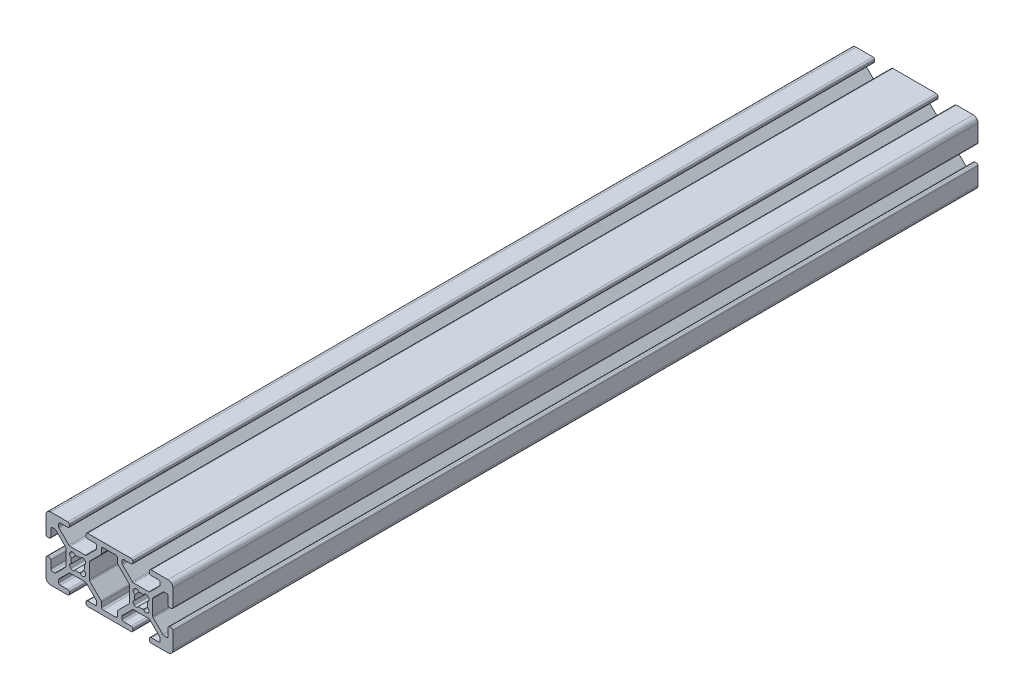
from build123d import *

# Parameters (mm, degrees)
EXTRUDE1_DEPTH = 254


with BuildPart() as part:
    # Sketch1 → Extrude1 (new body)
    with BuildSketch(Plane.XY):
        with BuildLine():
            Line((-36.908207136, -63.334998016), (-32.140368459, -63.334998016))
            ThreePointArc((-32.140368459, -63.334998016), (-31.945965275, -63.373667213), (-31.781158214, -63.483787771))
            Line((-31.781158214, -63.483787771), (-28.678077553, -66.586868432))
            ThreePointArc((-28.678077553, -66.586868432), (-28.567956995, -66.751675493), (-28.529287798, -66.946078677))
            Line((-28.529287798, -66.946078677), (-28.529287798, -67.671998016))
            ThreePointArc((-28.529287798, -67.671998016), (-28.678077553, -68.03120826), (-29.037287798, -68.179998016))
            Line((-29.037287798, -68.179998016), (-31.386287798, -68.179998016))
            ThreePointArc((-31.386287798, -68.179998016), (-31.745498042, -68.328787771), (-31.894287798, -68.687998016))
            Line((-31.894287798, -68.687998016), (-31.894287798, -69.171998016))
            ThreePointArc((-31.894287798, -69.171998016), (-31.745498042, -69.53120826), (-31.386287798, -69.679998016))
            Line((-31.386287798, -69.679998016), (-17.662287798, -69.679998016))
            ThreePointArc((-17.662287798, -69.679998016), (-17.303077553, -69.53120826), (-17.154287798, -69.171998016))
            Line((-17.154287798, -69.171998016), (-17.154287798, -68.687998016))
            ThreePointArc((-17.154287798, -68.687998016), (-17.303077553, -68.328787771), (-17.662287798, -68.179998016))
            Line((-17.662287798, -68.179998016), (-20.011287798, -68.179998016))
            ThreePointArc((-20.011287798, -68.179998016), (-20.370498042, -68.03120826), (-20.519287798, -67.671998016))
            Line((-20.519287798, -67.671998016), (-20.519287798, -66.946078677))
            ThreePointArc((-20.519287798, -66.946078677), (-20.4806186, -66.751675493), (-20.370498042, -66.586868432))
            Line((-20.370498042, -66.586868432), (-17.267417381, -63.483787771))
            ThreePointArc((-17.267417381, -63.483787771), (-17.10261032, -63.373667213), (-16.908207136, -63.334998016))
            Line((-16.908207136, -63.334998016), (-12.140368459, -63.334998016))
            ThreePointArc((-12.140368459, -63.334998016), (-11.945965275, -63.373667213), (-11.781158214, -63.483787771))
            Line((-11.781158214, -63.483787771), (-8.678077553, -66.586868432))
            ThreePointArc((-8.678077553, -66.586868432), (-8.567956995, -66.751675493), (-8.529287798, -66.946078677))
            Line((-8.529287798, -66.946078677), (-8.529287798, -67.671998016))
            ThreePointArc((-8.529287798, -67.671998016), (-8.678077553, -68.03120826), (-9.037287798, -68.179998016))
            Line((-9.037287798, -68.179998016), (-11.386287798, -68.179998016))
            ThreePointArc((-11.386287798, -68.179998016), (-11.745498042, -68.328787771), (-11.894287798, -68.687998016))
            Line((-11.894287798, -68.687998016), (-11.894287798, -69.171998016))
            ThreePointArc((-11.894287798, -69.171998016), (-11.745498042, -69.53120826), (-11.386287798, -69.679998016))
            Line((-11.386287798, -69.679998016), (-6.024287798, -69.679998016))
            ThreePointArc((-6.024287798, -69.679998016), (-4.963627626, -69.240658187), (-4.524287798, -68.179998016))
            Line((-4.524287798, -68.179998016), (-4.524287798, -62.817998016))
            ThreePointArc((-4.524287798, -62.817998016), (-4.673077553, -62.458787771), (-5.032287798, -62.309998016))
            Line((-5.032287798, -62.309998016), (-5.516287798, -62.309998016))
            ThreePointArc((-5.516287798, -62.309998016), (-5.875498042, -62.458787771), (-6.024287798, -62.817998016))
            Line((-6.024287798, -62.817998016), (-6.024287798, -65.166998016))
            ThreePointArc((-6.024287798, -65.166998016), (-6.173077553, -65.52620826), (-6.532287798, -65.674998016))
            Line((-6.532287798, -65.674998016), (-7.258207136, -65.674998016))
            ThreePointArc((-7.258207136, -65.674998016), (-7.45261032, -65.636328818), (-7.617417381, -65.52620826))
            Line((-7.617417381, -65.52620826), (-10.720498042, -62.423127599))
            ThreePointArc((-10.720498042, -62.423127599), (-10.8306186, -62.258320538), (-10.869287798, -62.063917354))
            Line((-10.869287798, -62.063917354), (-10.869287798, -57.296078677))
            ThreePointArc((-10.869287798, -57.296078677), (-10.8306186, -57.101675493), (-10.720498042, -56.936868432))
            Line((-10.720498042, -56.936868432), (-7.617417381, -53.833787771))
            ThreePointArc((-7.617417381, -53.833787771), (-7.45261032, -53.723667213), (-7.258207136, -53.684998016))
            Line((-7.258207136, -53.684998016), (-6.532287798, -53.684998016))
            ThreePointArc((-6.532287798, -53.684998016), (-6.173077553, -53.833787771), (-6.024287798, -54.192998016))
            Line((-6.024287798, -54.192998016), (-6.024287798, -56.541998016))
            ThreePointArc((-6.024287798, -56.541998016), (-5.875498042, -56.90120826), (-5.516287798, -57.049998016))
            Line((-5.516287798, -57.049998016), (-5.032287798, -57.049998016))
            ThreePointArc((-5.032287798, -57.049998016), (-4.673077553, -56.90120826), (-4.524287798, -56.541998016))
            Line((-4.524287798, -56.541998016), (-4.524287798, -51.179998016))
            ThreePointArc((-4.524287798, -51.179998016), (-4.963627626, -50.119337844), (-6.024287798, -49.679998016))
            Line((-6.024287798, -49.679998016), (-11.386287798, -49.679998016))
            ThreePointArc((-11.386287798, -49.679998016), (-11.745498042, -49.828787771), (-11.894287798, -50.187998016))
            Line((-11.894287798, -50.187998016), (-11.894287798, -50.671998016))
            ThreePointArc((-11.894287798, -50.671998016), (-11.745498042, -51.03120826), (-11.386287798, -51.179998016))
            Line((-11.386287798, -51.179998016), (-9.037287798, -51.179998016))
            ThreePointArc((-9.037287798, -51.179998016), (-8.678077553, -51.328787771), (-8.529287798, -51.687998016))
            Line((-8.529287798, -51.687998016), (-8.529287798, -52.413917354))
            ThreePointArc((-8.529287798, -52.413917354), (-8.567956995, -52.608320538), (-8.678077553, -52.773127599))
            Line((-8.678077553, -52.773127599), (-11.781158214, -55.87620826))
            ThreePointArc((-11.781158214, -55.87620826), (-11.945965275, -55.986328818), (-12.140368459, -56.024998016))
            Line((-12.140368459, -56.024998016), (-16.908207136, -56.024998016))
            ThreePointArc((-16.908207136, -56.024998016), (-17.10261032, -55.986328818), (-17.267417381, -55.87620826))
            Line((-17.267417381, -55.87620826), (-20.370498042, -52.773127599))
            ThreePointArc((-20.370498042, -52.773127599), (-20.4806186, -52.608320538), (-20.519287798, -52.413917354))
            Line((-20.519287798, -52.413917354), (-20.519287798, -51.687998016))
            ThreePointArc((-20.519287798, -51.687998016), (-20.370498042, -51.328787771), (-20.011287798, -51.179998016))
            Line((-20.011287798, -51.179998016), (-17.662287798, -51.179998016))
            ThreePointArc((-17.662287798, -51.179998016), (-17.303077553, -51.03120826), (-17.154287798, -50.671998016))
            Line((-17.154287798, -50.671998016), (-17.154287798, -50.187998016))
            ThreePointArc((-17.154287798, -50.187998016), (-17.303077553, -49.828787771), (-17.662287798, -49.679998016))
            Line((-17.662287798, -49.679998016), (-31.386287798, -49.679998016))
            ThreePointArc((-31.386287798, -49.679998016), (-31.745498042, -49.828787771), (-31.894287798, -50.187998016))
            Line((-31.894287798, -50.187998016), (-31.894287798, -50.671998016))
            ThreePointArc((-31.894287798, -50.671998016), (-31.745498042, -51.03120826), (-31.386287798, -51.179998016))
            Line((-31.386287798, -51.179998016), (-29.037287798, -51.179998016))
            ThreePointArc((-29.037287798, -51.179998016), (-28.678077553, -51.328787771), (-28.529287798, -51.687998016))
            Line((-28.529287798, -51.687998016), (-28.529287798, -52.413917354))
            ThreePointArc((-28.529287798, -52.413917354), (-28.567956995, -52.608320538), (-28.678077553, -52.773127599))
            Line((-28.678077553, -52.773127599), (-31.781158214, -55.87620826))
            ThreePointArc((-31.781158214, -55.87620826), (-31.945965275, -55.986328818), (-32.140368459, -56.024998016))
            Line((-32.140368459, -56.024998016), (-36.908207136, -56.024998016))
            ThreePointArc((-36.908207136, -56.024998016), (-37.10261032, -55.986328818), (-37.267417381, -55.87620826))
            Line((-37.267417381, -55.87620826), (-40.370498042, -52.773127599))
            ThreePointArc((-40.370498042, -52.773127599), (-40.4806186, -52.608320538), (-40.519287798, -52.413917354))
            Line((-40.519287798, -52.413917354), (-40.519287798, -51.687998016))
            ThreePointArc((-40.519287798, -51.687998016), (-40.370498042, -51.328787771), (-40.011287798, -51.179998016))
            Line((-40.011287798, -51.179998016), (-37.662287798, -51.179998016))
            ThreePointArc((-37.662287798, -51.179998016), (-37.303077553, -51.03120826), (-37.154287798, -50.671998016))
            Line((-37.154287798, -50.671998016), (-37.154287798, -50.187998016))
            ThreePointArc((-37.154287798, -50.187998016), (-37.303077553, -49.828787771), (-37.662287798, -49.679998016))
            Line((-37.662287798, -49.679998016), (-43.024287798, -49.679998016))
            ThreePointArc((-43.024287798, -49.679998016), (-44.084947969, -50.119337844), (-44.524287798, -51.179998016))
            Line((-44.524287798, -51.179998016), (-44.524287798, -56.541998016))
            ThreePointArc((-44.524287798, -56.541998016), (-44.375498042, -56.90120826), (-44.016287798, -57.049998016))
            Line((-44.016287798, -57.049998016), (-43.532287798, -57.049998016))
            ThreePointArc((-43.532287798, -57.049998016), (-43.173077553, -56.90120826), (-43.024287798, -56.541998016))
            Line((-43.024287798, -56.541998016), (-43.024287798, -54.192998016))
            ThreePointArc((-43.024287798, -54.192998016), (-42.875498042, -53.833787771), (-42.516287798, -53.684998016))
            Line((-42.516287798, -53.684998016), (-41.790368459, -53.684998016))
            ThreePointArc((-41.790368459, -53.684998016), (-41.595965275, -53.723667213), (-41.431158214, -53.833787771))
            Line((-41.431158214, -53.833787771), (-38.328077553, -56.936868432))
            ThreePointArc((-38.328077553, -56.936868432), (-38.217956995, -57.101675493), (-38.179287798, -57.296078677))
            Line((-38.179287798, -57.296078677), (-38.179287798, -62.063917354))
            ThreePointArc((-38.179287798, -62.063917354), (-38.217956995, -62.258320538), (-38.328077553, -62.423127599))
            Line((-38.328077553, -62.423127599), (-41.431158214, -65.52620826))
            ThreePointArc((-41.431158214, -65.52620826), (-41.595965275, -65.636328818), (-41.790368459, -65.674998016))
            Line((-41.790368459, -65.674998016), (-42.516287798, -65.674998016))
            ThreePointArc((-42.516287798, -65.674998016), (-42.875498042, -65.52620826), (-43.024287798, -65.166998016))
            Line((-43.024287798, -65.166998016), (-43.024287798, -62.817998016))
            ThreePointArc((-43.024287798, -62.817998016), (-43.173077553, -62.458787771), (-43.532287798, -62.309998016))
            Line((-43.532287798, -62.309998016), (-44.016287798, -62.309998016))
            ThreePointArc((-44.016287798, -62.309998016), (-44.375498042, -62.458787771), (-44.524287798, -62.817998016))
            Line((-44.524287798, -62.817998016), (-44.524287798, -68.179998016))
            ThreePointArc((-44.524287798, -68.179998016), (-44.084947969, -69.240658187), (-43.024287798, -69.679998016))
            Line((-43.024287798, -69.679998016), (-37.662287798, -69.679998016))
            ThreePointArc((-37.662287798, -69.679998016), (-37.303077553, -69.53120826), (-37.154287798, -69.171998016))
            Line((-37.154287798, -69.171998016), (-37.154287798, -68.687998016))
            ThreePointArc((-37.154287798, -68.687998016), (-37.303077553, -68.328787771), (-37.662287798, -68.179998016))
            Line((-37.662287798, -68.179998016), (-40.011287798, -68.179998016))
            ThreePointArc((-40.011287798, -68.179998016), (-40.370498042, -68.03120826), (-40.519287798, -67.671998016))
            Line((-40.519287798, -67.671998016), (-40.519287798, -66.946078677))
            ThreePointArc((-40.519287798, -66.946078677), (-40.4806186, -66.751675493), (-40.370498042, -66.586868432))
            Line((-40.370498042, -66.586868432), (-37.267417381, -63.483787771))
            ThreePointArc((-37.267417381, -63.483787771), (-37.10261032, -63.373667213), (-36.908207136, -63.334998016))
        make_face()
        with BuildLine():
            Line((-16.649188641, -61.984503982), (-16.828793764, -61.804898859))
            ThreePointArc((-16.828793764, -61.804898859), (-17.030225814, -61.036465826), (-16.459421304, -60.483974734))
            ThreePointArc((-16.459421304, -60.483974734), (-16.619787798, -59.679998016), (-16.459421304, -58.876021298))
            ThreePointArc((-16.459421304, -58.876021298), (-17.030225814, -58.323530205), (-16.828793764, -57.555097172))
            Line((-16.828793764, -57.555097172), (-16.649188641, -57.375492049))
            ThreePointArc((-16.649188641, -57.375492049), (-15.880755608, -57.174059999), (-15.328264516, -57.744864509))
            ThreePointArc((-15.328264516, -57.744864509), (-14.524287798, -57.584498016), (-13.72031108, -57.744864509))
            ThreePointArc((-13.72031108, -57.744864509), (-13.167819987, -57.174059999), (-12.399386954, -57.375492049))
            Line((-12.399386954, -57.375492049), (-12.219781831, -57.555097172))
            ThreePointArc((-12.219781831, -57.555097172), (-12.018349781, -58.323530205), (-12.589154291, -58.876021298))
            ThreePointArc((-12.589154291, -58.876021298), (-12.428787798, -59.679998016), (-12.589154291, -60.483974734))
            ThreePointArc((-12.589154291, -60.483974734), (-12.018349781, -61.036465826), (-12.219781831, -61.804898859))
            Line((-12.219781831, -61.804898859), (-12.399386954, -61.984503982))
            ThreePointArc((-12.399386954, -61.984503982), (-13.167819987, -62.185936032), (-13.72031108, -61.615131522))
            ThreePointArc((-13.72031108, -61.615131522), (-14.524287798, -61.775498016), (-15.328264516, -61.615131522))
            ThreePointArc((-15.328264516, -61.615131522), (-15.880755608, -62.185936032), (-16.649188641, -61.984503982))
        make_face(mode=Mode.SUBTRACT)
        with BuildLine():
            Line((-27.029287798, -67.671998016), (-27.029287798, -66.324758333))
            ThreePointArc((-27.029287798, -66.324758333), (-27.067956995, -66.13035515), (-27.178077553, -65.965548089))
            Line((-27.178077553, -65.965548089), (-30.720498042, -62.423127599))
            ThreePointArc((-30.720498042, -62.423127599), (-30.8306186, -62.258320538), (-30.869287798, -62.063917354))
            Line((-30.869287798, -62.063917354), (-30.869287798, -57.296078677))
            ThreePointArc((-30.869287798, -57.296078677), (-30.8306186, -57.101675493), (-30.720498042, -56.936868432))
            Line((-30.720498042, -56.936868432), (-27.178077553, -53.394447942))
            ThreePointArc((-27.178077553, -53.394447942), (-27.067956995, -53.229640881), (-27.029287798, -53.035237698))
            Line((-27.029287798, -53.035237698), (-27.029287798, -51.687998016))
            ThreePointArc((-27.029287798, -51.687998016), (-26.880498042, -51.328787771), (-26.521287798, -51.179998016))
            Line((-26.521287798, -51.179998016), (-22.527287798, -51.179998016))
            ThreePointArc((-22.527287798, -51.179998016), (-22.168077553, -51.328787771), (-22.019287798, -51.687998016))
            Line((-22.019287798, -51.687998016), (-22.019287798, -53.035237698))
            ThreePointArc((-22.019287798, -53.035237698), (-21.9806186, -53.229640881), (-21.870498042, -53.394447942))
            Line((-21.870498042, -53.394447942), (-18.328077553, -56.936868432))
            ThreePointArc((-18.328077553, -56.936868432), (-18.217956995, -57.101675493), (-18.179287798, -57.296078677))
            Line((-18.179287798, -57.296078677), (-18.179287798, -62.063917354))
            ThreePointArc((-18.179287798, -62.063917354), (-18.217956995, -62.258320538), (-18.328077553, -62.423127599))
            Line((-18.328077553, -62.423127599), (-21.870498042, -65.965548089))
            ThreePointArc((-21.870498042, -65.965548089), (-21.9806186, -66.13035515), (-22.019287798, -66.324758333))
            Line((-22.019287798, -66.324758333), (-22.019287798, -67.671998016))
            ThreePointArc((-22.019287798, -67.671998016), (-22.168077553, -68.03120826), (-22.527287798, -68.179998016))
            Line((-22.527287798, -68.179998016), (-26.521287798, -68.179998016))
            ThreePointArc((-26.521287798, -68.179998016), (-26.880498042, -68.03120826), (-27.029287798, -67.671998016))
        make_face(mode=Mode.SUBTRACT)
        with BuildLine():
            Line((-36.649188641, -61.984503982), (-36.828793764, -61.804898859))
            ThreePointArc((-36.828793764, -61.804898859), (-37.030225814, -61.036465826), (-36.459421304, -60.483974734))
            ThreePointArc((-36.459421304, -60.483974734), (-36.619787798, -59.679998016), (-36.459421304, -58.876021298))
            ThreePointArc((-36.459421304, -58.876021298), (-37.030225814, -58.323530205), (-36.828793764, -57.555097172))
            Line((-36.828793764, -57.555097172), (-36.649188641, -57.375492049))
            ThreePointArc((-36.649188641, -57.375492049), (-35.880755608, -57.174059999), (-35.328264516, -57.744864509))
            ThreePointArc((-35.328264516, -57.744864509), (-34.524287798, -57.584498016), (-33.72031108, -57.744864509))
            ThreePointArc((-33.72031108, -57.744864509), (-33.167819987, -57.174059999), (-32.399386954, -57.375492049))
            Line((-32.399386954, -57.375492049), (-32.219781831, -57.555097172))
            ThreePointArc((-32.219781831, -57.555097172), (-32.018349781, -58.323530205), (-32.589154291, -58.876021298))
            ThreePointArc((-32.589154291, -58.876021298), (-32.428787798, -59.679998016), (-32.589154291, -60.483974734))
            ThreePointArc((-32.589154291, -60.483974734), (-32.018349781, -61.036465826), (-32.219781831, -61.804898859))
            Line((-32.219781831, -61.804898859), (-32.399386954, -61.984503982))
            ThreePointArc((-32.399386954, -61.984503982), (-33.167819987, -62.185936032), (-33.72031108, -61.615131522))
            ThreePointArc((-33.72031108, -61.615131522), (-34.524287798, -61.775498016), (-35.328264516, -61.615131522))
            ThreePointArc((-35.328264516, -61.615131522), (-35.880755608, -62.185936032), (-36.649188641, -61.984503982))
        make_face(mode=Mode.SUBTRACT)
    extrude(amount=EXTRUDE1_DEPTH)


solid = part.part
